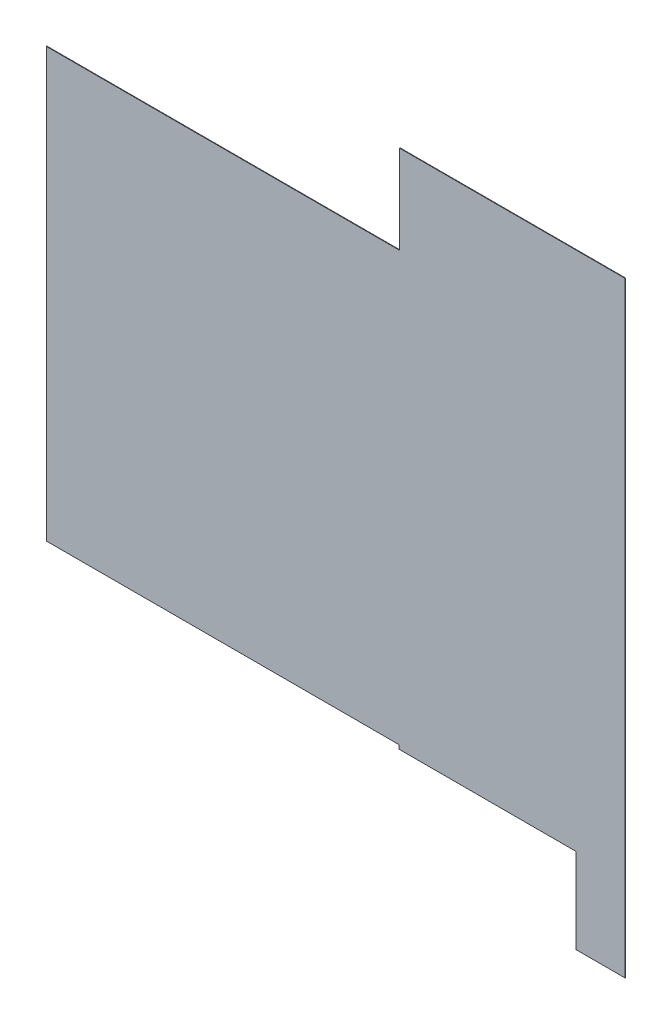
from build123d import *

# Parameters (mm, degrees)
BOSS_EXTRUDE1_DEPTH = 2
CUT_EXTRUDE2_DEPTH  = 330


with BuildPart() as part:
    # Sketch1 → Boss-Extrude1 (new body)
    with BuildSketch(Plane.XY):
        Polygon((1242, 1506), (0, 1506), (0, 0), (1239.998813056, 0), (1239.998813056, -14), (1672.998813056, -14), (1672.998813056, -313), (2035, -313), (2035, 1817), (1242, 1817), align=None)
    extrude(amount=BOSS_EXTRUDE1_DEPTH)

    # Sketch3 → Cut-Extrude2 (cut)
    with BuildSketch(Plane(origin=(-124.112118138, -344, 1006.457487155), x_dir=(-1, 0, 0), z_dir=(0, -1, 0))):
        with BuildLine():
            Line((-1887.112118138, 819.457487155), (-1466.112118138, 819.457487155))
            ThreePointArc((-1466.112118138, 819.457487155), (-1395.40144002, 848.746809036), (-1366.112118138, 919.457487155))
            Line((-1366.112118138, 919.457487155), (-1366.112118138, 2569.457487155))
            ThreePointArc((-1366.112118138, 2569.457487155), (-1395.40144002, 2640.168165273), (-1466.112118138, 2669.457487155))
            Line((-1466.112118138, 2669.457487155), (-1887.112118138, 2669.457487155))
            ThreePointArc((-1887.112118138, 2669.457487155), (-1957.822796257, 2640.168165273), (-1987.112118138, 2569.457487155))
            Line((-1987.112118138, 2569.457487155), (-1987.112118138, 919.457487155))
            ThreePointArc((-1987.112118138, 919.457487155), (-1957.822796257, 848.746809036), (-1887.112118138, 819.457487155))
        make_face()
    extrude(amount=-CUT_EXTRUDE2_DEPTH, mode=Mode.SUBTRACT)


solid = part.part
